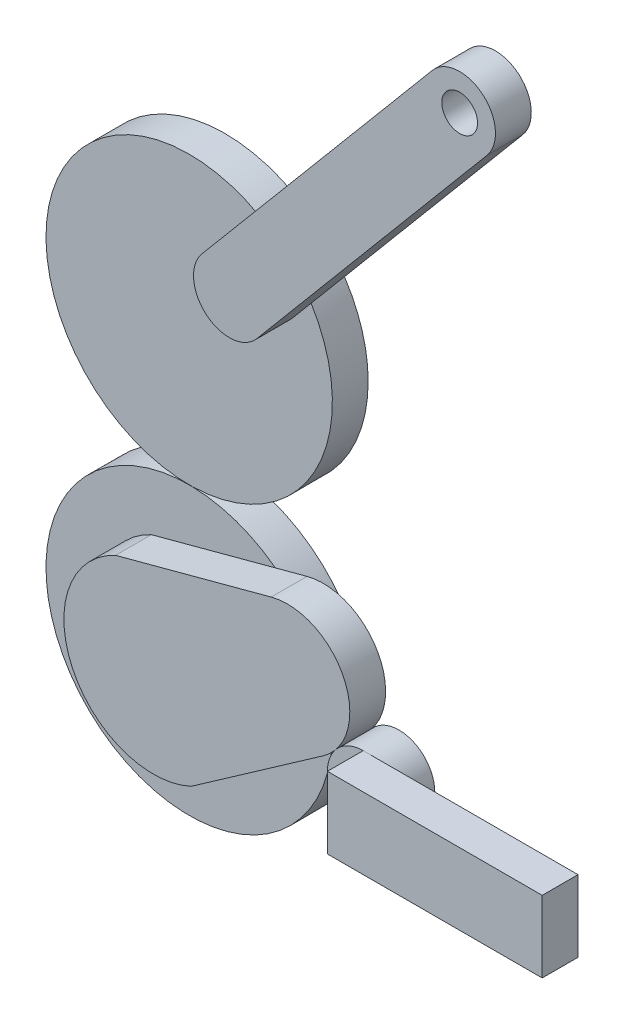
from build123d import *

# Parameters (mm, degrees)
SKETCH_1_R          = 40
EXTRUDE_1_DEPTH     = 10
SKETCH_2_R          = 40
EXTRUDE_2_DEPTH     = 10
EXTRUDE_3_DEPTH     = 10
EXTRUDE_START       = 10
SKETCH_4_R          = 10
EXTRUDE_4_DEPTH     = 10
SKETCH_5_W          = 60
SKETCH_5_H          = 20
EXTRUDE_5_DEPTH     = 10
SKETCH_6_R          = 5
CUT_EXTRUDE_1_DEPTH = 10
EXTRUDE_6_DEPTH     = 10
SKETCH_8_R          = 5
CUT_EXTRUDE_2_DEPTH = 10


with BuildPart() as part:
    # 草图1 → 凸台-拉伸1 (new body)
    with BuildSketch(Plane.XY):
        Circle(SKETCH_1_R)
    extrude(amount=EXTRUDE_1_DEPTH)

    # 草图6 → 切除-拉伸1 (cut)
    with BuildSketch(Plane.XY.offset(10)):
        with Locations((21.213203436, 21.213203436)):
            Circle(SKETCH_6_R)
    extrude(amount=-CUT_EXTRUDE_1_DEPTH, mode=Mode.SUBTRACT)

    # 草图7 → 凸台-拉伸6 (add)
    with BuildSketch(Plane.XY.offset(10)):
        with BuildLine():
            Line((13.558194714, 27.647552002), (77.901680374, 104.19763922))
            ThreePointArc((77.901680374, 104.19763922), (91.991037662, 105.418299375), (93.211697818, 91.328942088))
            Line((93.211697818, 91.328942088), (28.868212157, 14.77885487))
            ThreePointArc((28.868212157, 14.77885487), (14.77885487, 13.558194714), (13.558194714, 27.647552002))
        make_face()
    extrude(amount=EXTRUDE_6_DEPTH)

    # 草图8 → 切除-拉伸2 (cut)
    with BuildSketch(Plane.XY.offset(20)):
        with Locations((85.556689096, 97.763290654)):
            Circle(SKETCH_8_R)
    extrude(amount=-CUT_EXTRUDE_2_DEPTH, mode=Mode.SUBTRACT)


with BuildPart() as body_2:
    # 草图2 → 凸台-拉伸2 (new body)
    with BuildSketch(Plane.XY):
        with Locations((0, -80)):
            Circle(SKETCH_2_R)
    extrude(amount=EXTRUDE_2_DEPTH)

    # 草图3 → 凸台-拉伸3 (add)
    with BuildSketch(Plane.XY.offset(10)):
        with BuildLine():
            Line((-10.565456544, -57.342305324), (32.901205639, -45.695448294))
            ThreePointArc((32.901205639, -45.695448294), (53.233777088, -55.176682071), (47.427298537, -76.84675504))
            Line((47.427298537, -76.84675504), (10.565456544, -102.657694676))
            ThreePointArc((10.565456544, -102.657694676), (-22.657694676, -90.565456544), (-10.565456544, -57.342305324))
        make_face()
    extrude(amount=EXTRUDE_3_DEPTH)


with BuildPart() as body_3:
    # 草图4 → 凸台-拉伸4 (new body)
    with BuildSketch(Plane.XY.offset(EXTRUDE_START)):
        with Locations((58.610156078, -80)):
            Circle(SKETCH_4_R)
    extrude(amount=EXTRUDE_4_DEPTH)

    # 草图5 → 凸台-拉伸5 (add)
    with BuildSketch(Plane.XY.offset(20)):
        with Locations((88.610156078, -80)):
            Rectangle(SKETCH_5_W, SKETCH_5_H)
    extrude(amount=EXTRUDE_5_DEPTH)


solid = Compound([part.part, body_2.part, body_3.part])
